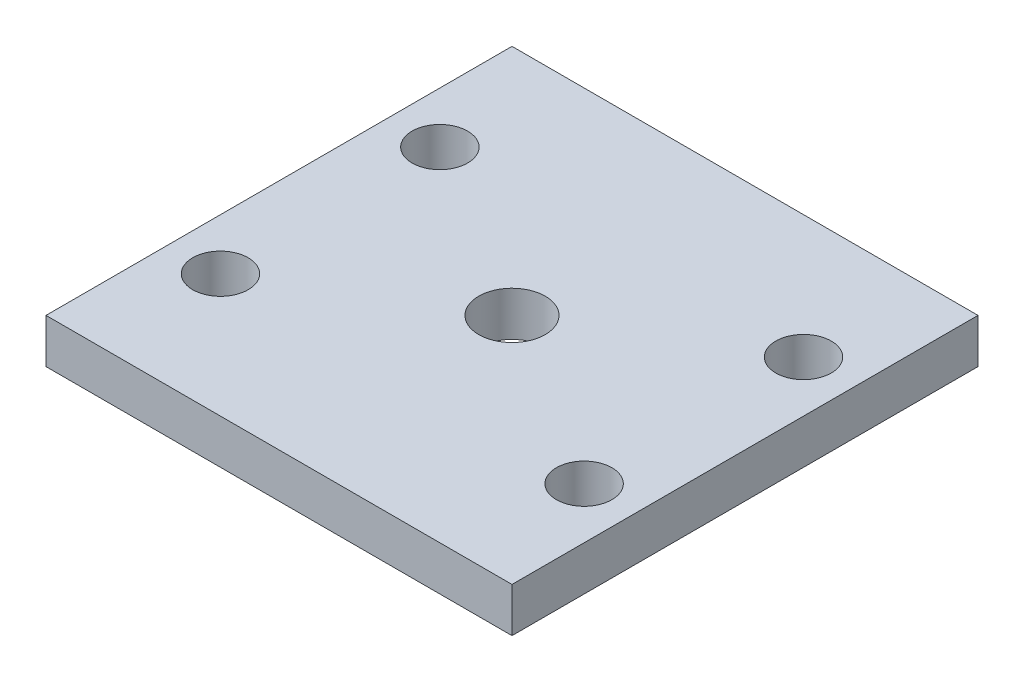
from build123d import *

# Parameters (mm, degrees)
SKETCH1_W                 = 42
SKETCH1_H                 = 42
BOSS_EXTRUDE1_DEPTH       = 4
SKETCH2_R                 = 3
CUT_EXTRUDE1_DEPTH        = 16
F_5_0MM_DOWEL_HOLE1_D     = 5
F_5_0MM_DOWEL_HOLE1_DEPTH = 25
F_5_0MM_DOWEL_HOLE1_TIP   = 1.502151548


with BuildPart() as part:
    # Sketch1 → Boss-Extrude1 (new body)
    with BuildSketch(Plane(origin=(0, 0, 0), x_dir=(1, 0, 0), z_dir=(0, 1, 0))):
        with Locations((1.276868931, -0.638434466)):
            Rectangle(SKETCH1_W, SKETCH1_H)
    extrude(amount=BOSS_EXTRUDE1_DEPTH)

    # Sketch2 → Cut-Extrude1 (cut)
    with BuildSketch(Plane(origin=(0, 4, 0), x_dir=(1, 0, 0), z_dir=(0, 1, 0))):
        with Locations(Location((1.276868931, -0.638434466, 0), (0, 0, 270))):
            Circle(SKETCH2_R)
    extrude(amount=-CUT_EXTRUDE1_DEPTH, mode=Mode.SUBTRACT)

    # Ø5.0mm Dowel Hole1
    with Locations(Plane(origin=(0, 4, 0), x_dir=(1, 0, 0), z_dir=(0, 1, 0))):
        with Locations((-15.111953931, -10.525403014), (-15.111953931, 9.248534083), (17.665691793, 9.248534083), (17.665691793, -10.525403014)):
            Hole(F_5_0MM_DOWEL_HOLE1_D / 2, depth=F_5_0MM_DOWEL_HOLE1_DEPTH)
            with Locations((0, 0, -(F_5_0MM_DOWEL_HOLE1_DEPTH + F_5_0MM_DOWEL_HOLE1_TIP / 2))):  # 118° drill point
                Cone(0, F_5_0MM_DOWEL_HOLE1_D / 2, F_5_0MM_DOWEL_HOLE1_TIP, mode=Mode.SUBTRACT)


solid = part.part
